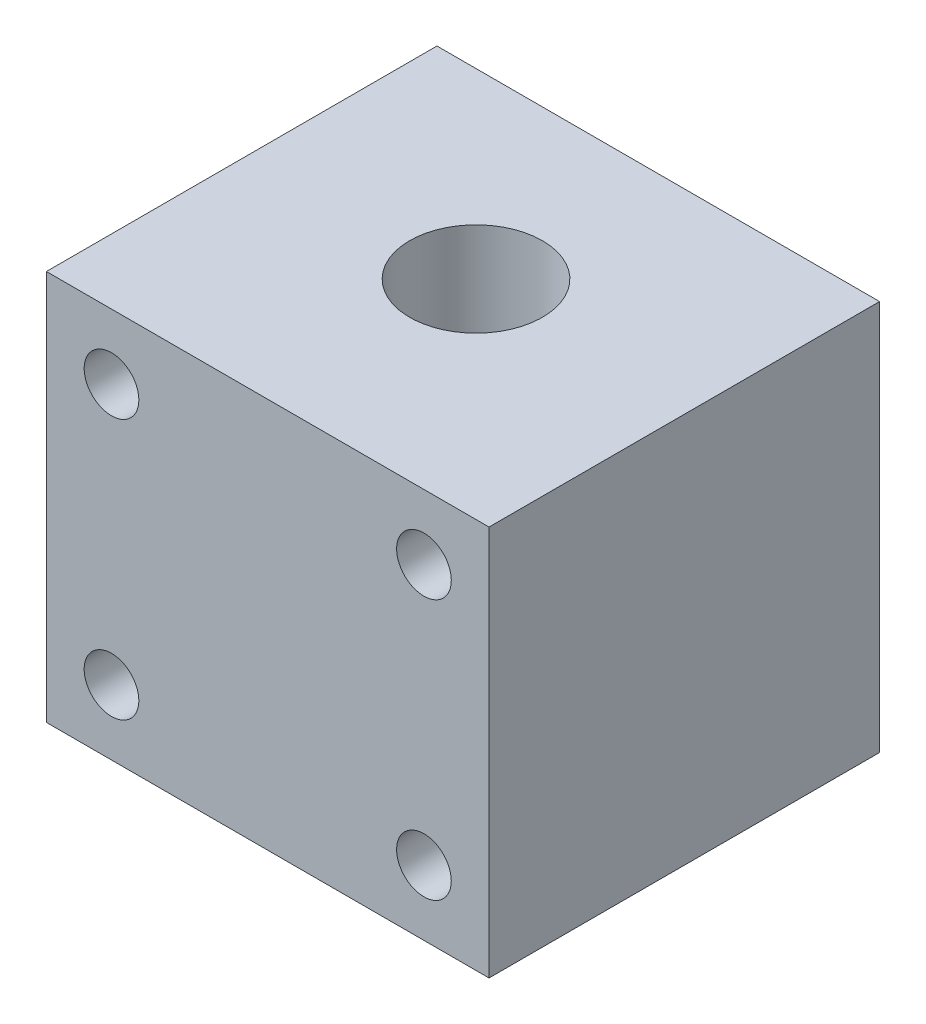
from build123d import *

# Parameters (mm, degrees)
SKETCH_1_W          = 34
SKETCH_1_H          = 30
EXTRUDE_1_DEPTH     = 30
SKETCH_2_R          = 5.1
CUT_EXTRUDE_1_DEPTH = 38.603191354
SKETCH_3_R          = 1.55
CUT_EXTRUDE_2_DEPTH = 15
SKETCH_4_R          = 2.1
CUT_EXTRUDE_3_DEPTH = 20


with BuildPart() as part:
    # 草图1 → 凸台-拉伸1 (new body)
    with BuildSketch(Plane(origin=(0, 0, 0), x_dir=(1, 0, 0), z_dir=(0, 1, 0))):
        Rectangle(SKETCH_1_W, SKETCH_1_H)
    extrude(amount=EXTRUDE_1_DEPTH)

    # 草图2 → 切除-拉伸1 (cut, through all)
    with BuildSketch(Plane(origin=(0, 0, 0), x_dir=(-1, 0, 0), z_dir=(0, -1, 0))):
        with Locations(Location((0, 1, 0), (0, 0, 90))):
            Circle(SKETCH_2_R)
    extrude(amount=-CUT_EXTRUDE_1_DEPTH, mode=Mode.SUBTRACT)

    # 草图3 → 切除-拉伸2 (cut)
    with BuildSketch(Plane(origin=(0, 0, 0), x_dir=(-1, 0, 0), z_dir=(0, -1, 0))):
        with Locations(Location((8, 1, 0), (0, 0, 90))):
            Circle(SKETCH_3_R)
        with Locations(Location((0, -7, 0), (0, 0, 90))):
            Circle(SKETCH_3_R)
        with Locations(Location((-8, 1, 0), (0, 0, 90))):
            Circle(SKETCH_3_R)
        with Locations(Location((0, 9, 0), (0, 0, 90))):
            Circle(SKETCH_3_R)
    extrude(amount=-CUT_EXTRUDE_2_DEPTH, mode=Mode.SUBTRACT)

    # 草图4 → 切除-拉伸3 (cut)
    with BuildSketch(Plane.XY.offset(15)):
        with Locations((-12, 5)):
            Circle(SKETCH_4_R)
        with Locations((12, 5)):
            Circle(SKETCH_4_R)
        with Locations((12, 25)):
            Circle(SKETCH_4_R)
        with Locations((-12, 25)):
            Circle(SKETCH_4_R)
    extrude(amount=-CUT_EXTRUDE_3_DEPTH, mode=Mode.SUBTRACT)


solid = part.part
